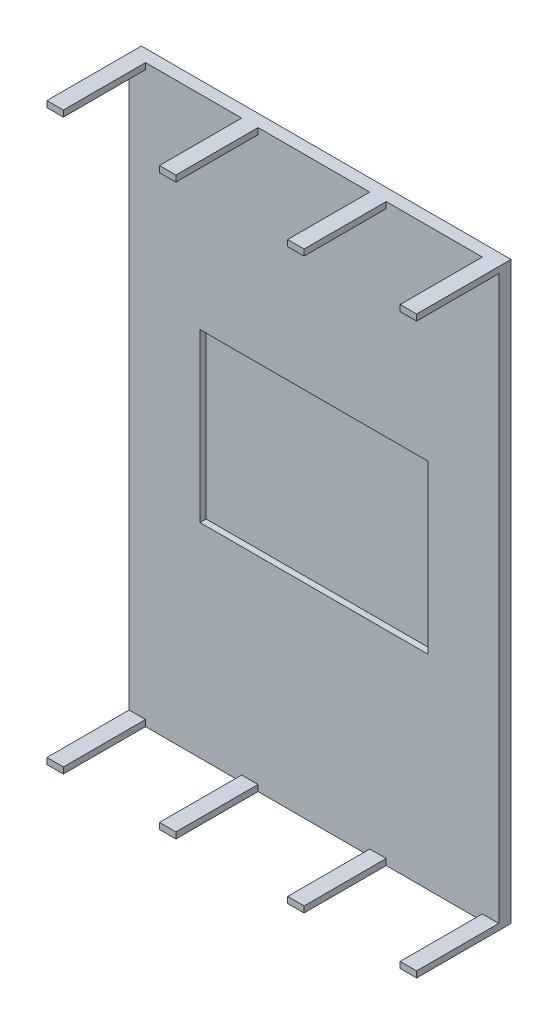
from build123d import *

# Parameters (mm, degrees)
SKETCH1_W           = 140
SKETCH1_H           = 90
BOSS_EXTRUDE1_DEPTH = 3
SKETCH2_W           = 4
SKETCH2_H           = 1.5
BOSS_EXTRUDE2_DEPTH = 20
SKETCH4_W           = 55.5
SKETCH4_H           = 40.7
CUT_EXTRUDE1_DEPTH  = 1.5


with BuildPart() as part:
    # Sketch1 → Boss-Extrude1 (new body)
    with BuildSketch(Plane(origin=(0, 0, 0), x_dir=(0, 1, 0), z_dir=(0, 0, 1))):
        Rectangle(SKETCH1_W, SKETCH1_H)
    extrude(amount=BOSS_EXTRUDE1_DEPTH)

    # Sketch2 → Boss-Extrude2 (add)
    with BuildSketch(Plane.XY.offset(3)):
        with Locations((-43, 69.25)):
            Rectangle(SKETCH2_W, SKETCH2_H)
        with Locations((-15.6, 69.25)):
            Rectangle(SKETCH2_W, SKETCH2_H)
        with Locations((15.6, 69.25)):
            Rectangle(SKETCH2_W, SKETCH2_H)
        with Locations((43, 69.25)):
            Rectangle(SKETCH2_W, SKETCH2_H)
        with Locations((-43, -69.25)):
            Rectangle(SKETCH2_W, SKETCH2_H)
        with Locations((-15.6, -69.25)):
            Rectangle(SKETCH2_W, SKETCH2_H)
        with Locations((15.6, -69.25)):
            Rectangle(SKETCH2_W, SKETCH2_H)
        with Locations((43, -69.25)):
            Rectangle(SKETCH2_W, SKETCH2_H)
    extrude(amount=BOSS_EXTRUDE2_DEPTH)

    # Sketch4 → Cut-Extrude1 (cut)
    with BuildSketch(Plane.XY.offset(3)):
        Rectangle(SKETCH4_W, SKETCH4_H)
    extrude(amount=-CUT_EXTRUDE1_DEPTH, mode=Mode.SUBTRACT)


solid = part.part
